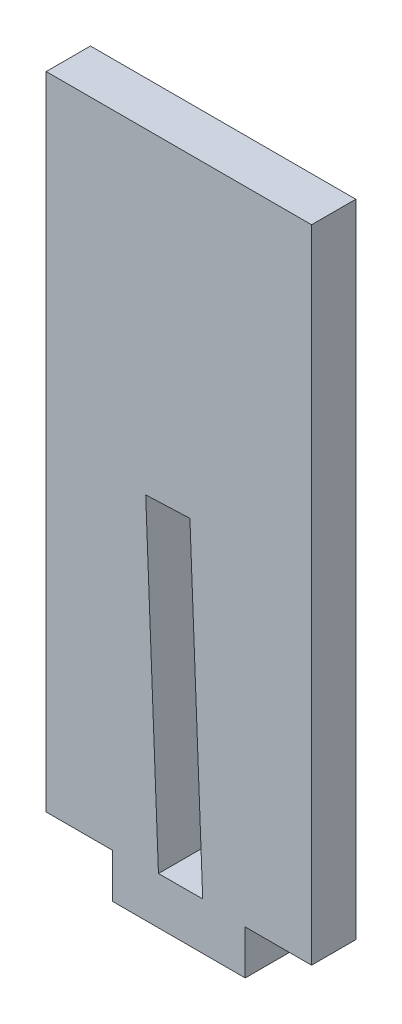
from build123d import *

# Parameters (mm, degrees)
EXTRUDE_1_DEPTH     = 2
SKETCH_3_W          = 12
SKETCH_3_H          = 1.078774048
CUT_EXTRUDE_2_DEPTH = 10
CUT_EXTRUDE_3_DEPTH = 2


with BuildPart() as part:
    # 草图1 → 凸台-拉伸1 (new body)
    with BuildSketch(Plane.XY):
        Polygon((-6, 0), (-6, 15), (-6, 30.078774409), (6, 30.078774409), (6, 15), (6, 0), (3, 0), (3, -2), (-3, -2), (-3, 0), align=None)
    extrude(amount=EXTRUDE_1_DEPTH)

    # 草图3 → 切除-拉伸2 (cut)
    with BuildSketch(Plane.XY.offset(2)):
        with Locations((0, 29.539387385)):
            Rectangle(SKETCH_3_W, SKETCH_3_H)
        Polygon((6, 29.000000361), (10.298878861, 29.000000361), (10.298878861, 34.143483695), (-9.585000786, 34.143483695), (-9.585000786, 29.000000361), (-6, 29.000000361), (-6, 30.078774409), (6, 30.078774409), align=None)
    extrude(amount=-CUT_EXTRUDE_2_DEPTH, mode=Mode.SUBTRACT)

    # 草图4 → 切除-拉伸3 (cut)
    with BuildSketch(Plane.XY.offset(2)):
        Polygon((1.077177439, 0.134865294), (-0.924163416, 0.129099689), (-1.488199796, 14.364474695), (-1.500339051, 14.670850059), (0.498092879, 14.750032259), align=None)
    extrude(amount=-CUT_EXTRUDE_3_DEPTH, mode=Mode.SUBTRACT)


solid = part.part
